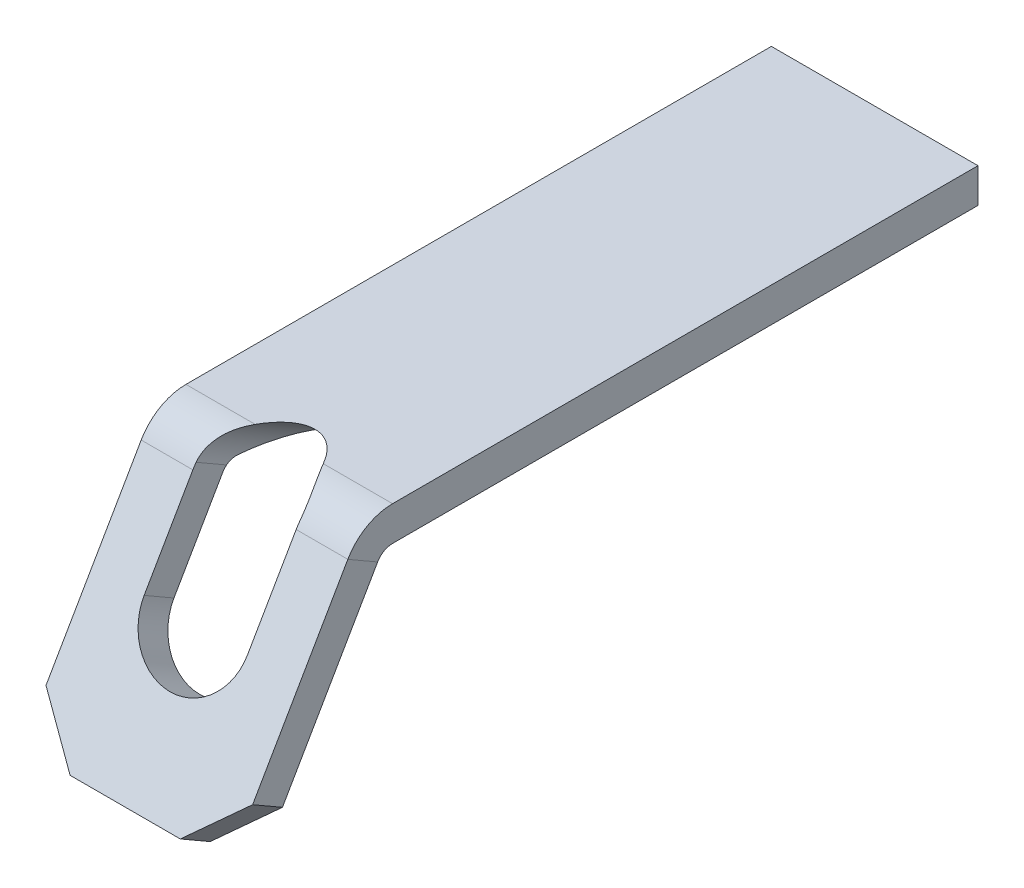
from build123d import *

# Parameters (mm, degrees)
SKETCH1_W           = 3
SKETCH1_H           = 8.5
BOSS_EXTRUDE1_DEPTH = 0.25
SKETCH4_W           = 3
SKETCH4_H           = 0.5
CUT_EXTRUDE1_DEPTH  = 10.698686397
CHAMFER1_SIZE       = 0.7


with BuildPart() as part:
    # Sketch1 → Boss-Extrude1 (new, symmetric)
    with BuildSketch(Plane(origin=(0, 0, 0), x_dir=(1, 0, 0), z_dir=(0, 1, 0))):
        Rectangle(SKETCH1_W, SKETCH1_H)
    extrude(amount=BOSS_EXTRUDE1_DEPTH, both=True)

    # Sweep1: sweep along a path in Sketch5
    with BuildLine(Plane(origin=(0, 0, 0), x_dir=(0, 0, -1), z_dir=(1, 0, 0))) as sweep1_path:
        Line((-6.415063509, -3.25), (-4.683012702, -0.25))
        ThreePointArc((-4.683012702, -0.25), (-4.5, -0.066987298), (-4.25, 0))
    # Sketch4 → Sweep1 (sweep)
    with BuildSketch(Plane.XY.offset(4.25)):
        Rectangle(SKETCH4_W, SKETCH4_H)
    sweep(path=sweep1_path.line)

    # Sketch6 → Cut-Extrude1 (cut, through all)
    with BuildSketch(Plane(origin=(0, 2.090303983, 3.620512702), x_dir=(1, 0, 0), z_dir=(0, 0.500000000000001, 0.8660254037844382))):
        with BuildLine():
            Line((0.75, -2.472114317), (0.75, -3.972114317))
            ThreePointArc((0.75, -3.972114317), (0, -4.722114317), (-0.75, -3.972114317))
            Line((-0.75, -3.972114317), (-0.75, -2.472114317))
            ThreePointArc((-0.75, -2.472114317), (0, -1.722114317), (0.75, -2.472114317))
        make_face()
    extrude(amount=-CUT_EXTRUDE1_DEPTH, mode=Mode.SUBTRACT)

    # Chamfer1
    chamfer1_edges = [part.edges().sort_by_distance(p)[0] for p in [
        (-1.5, -3.25, 6.415063509),
        (1.5, -3.25, 6.415063509),
    ]]
    chamfer(chamfer1_edges, length=CHAMFER1_SIZE)


solid = part.part
